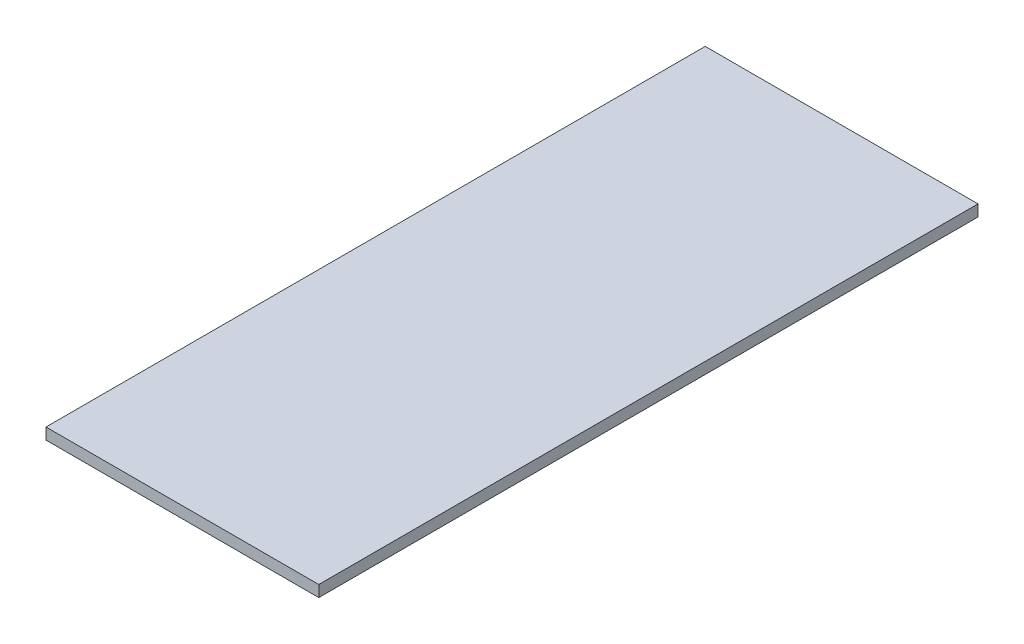
from build123d import *

# Parameters (mm, degrees)
SKIZZE1_W                       = 120
SKIZZE1_H                       = 290
AUFSATZ_LINEAR_AUSTRAGEN1_DEPTH = 5


with BuildPart() as part:
    # Skizze1 → Aufsatz-Linear austragen1 (new body)
    with BuildSketch(Plane(origin=(0, 0, 0), x_dir=(1, 0, 0), z_dir=(0, 1, 0))):
        Rectangle(SKIZZE1_W, SKIZZE1_H)
    extrude(amount=AUFSATZ_LINEAR_AUSTRAGEN1_DEPTH)


solid = part.part
